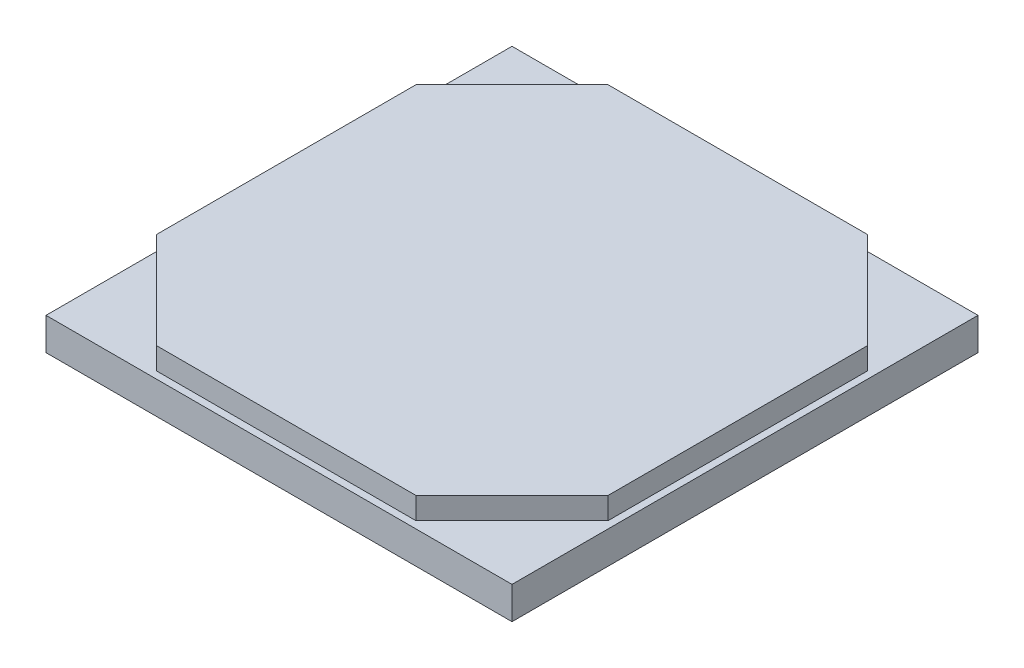
from build123d import *

# Parameters (mm, degrees)
SKETCH_1_W      = 9.8
SKETCH_1_H      = 0.68
EXTRUDE_1_DEPTH = 9.8
EXTRUDE_2_DEPTH = 0.46


with BuildPart() as part:
    # Эскиз1 → Бобышка-Вытянуть1 (new body)
    with BuildSketch(Plane(origin=(0, 0, 0), x_dir=(0, 0, -1), z_dir=(1, 0, 0))):
        with Locations((-2.397426888, 0.51364793)):
            Rectangle(SKETCH_1_W, SKETCH_1_H)
    extrude(amount=EXTRUDE_1_DEPTH)

    # Эскиз3 → Бобышка-Вытянуть2 (add)
    with BuildSketch(Plane(origin=(0, 0.85364793, 0), x_dir=(1, 0, 0), z_dir=(0, 1, 0))):
        Polygon((7.63, 2.352573112), (2.17, 2.352573112), (0.15, 0.332573112), (0.15, -5.127426888), (2.17, -7.147426888), (7.63, -7.147426888), (9.65, -5.127426888), (9.65, 0.332573112), align=None)
    extrude(amount=EXTRUDE_2_DEPTH)


solid = part.part
